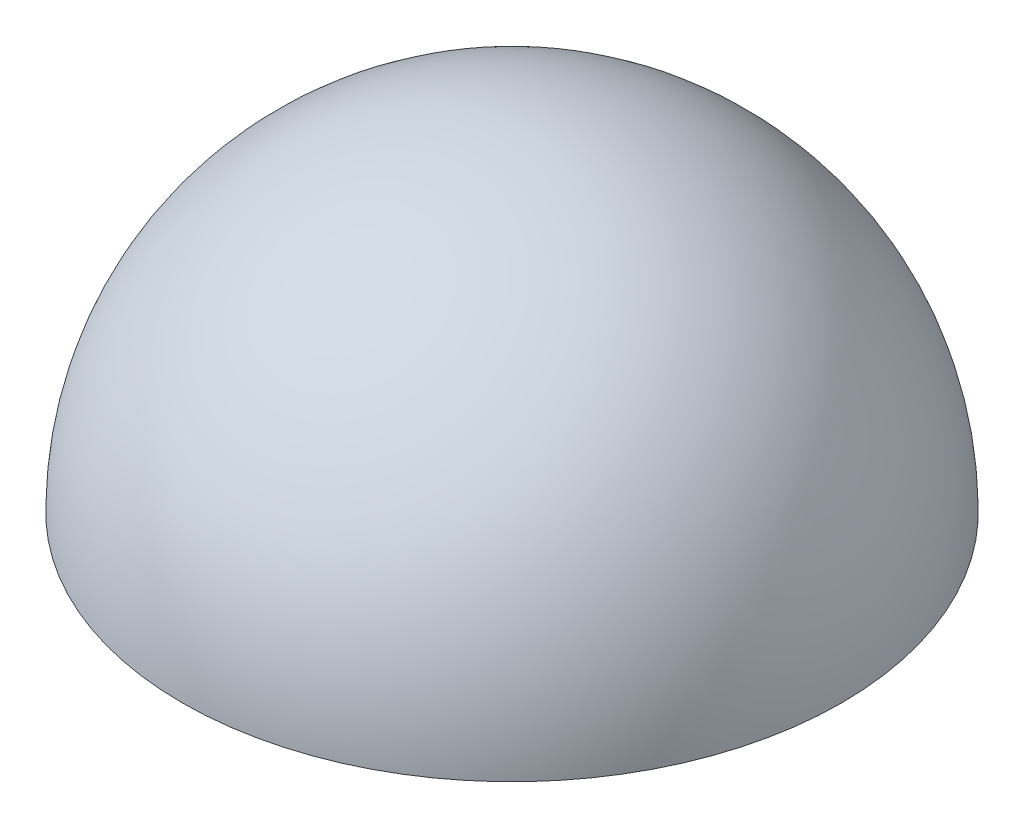
from build123d import *


with BuildPart() as part:
    # Sketch1 → Revolve1 (revolve)
    with BuildSketch(Plane.XY):
        with BuildLine():
            Line((0, 25), (0, 23))
            ThreePointArc((0, 23), (16.263455967, 16.263455967), (23, 0))
            Line((23, 0), (25, 0))
            ThreePointArc((25, 0), (17.67766953, 17.67766953), (0, 25))
        make_face()
    revolve(axis=Axis((0, 29.462489614, 0), (0, -1, 0)))


solid = part.part
